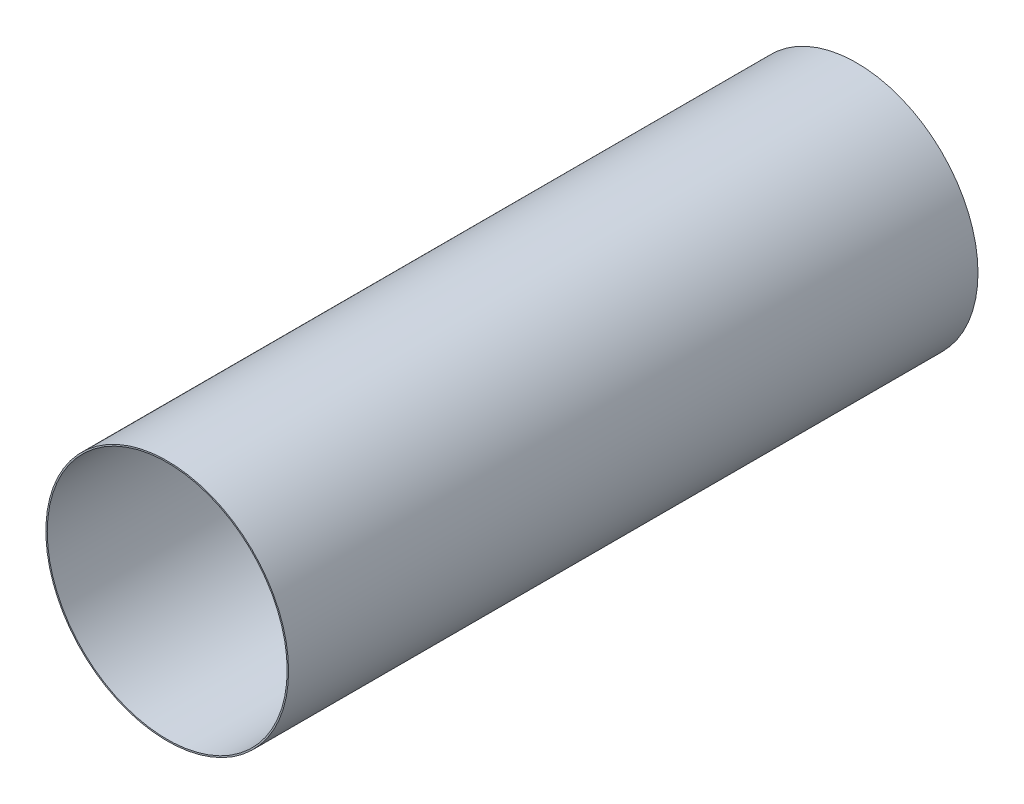
from build123d import *

# Parameters (mm, degrees)
SKETCH1_R           = 2130.0235
SKETCH1_R_2         = 2105.5785
BOSS_EXTRUDE1_DEPTH = 12100


with BuildPart() as part:
    # Sketch1 → Boss-Extrude1 (new body)
    with BuildSketch(Plane.XY):
        Circle(SKETCH1_R)
        Circle(SKETCH1_R_2, mode=Mode.SUBTRACT)
    extrude(amount=-BOSS_EXTRUDE1_DEPTH)


solid = part.part
